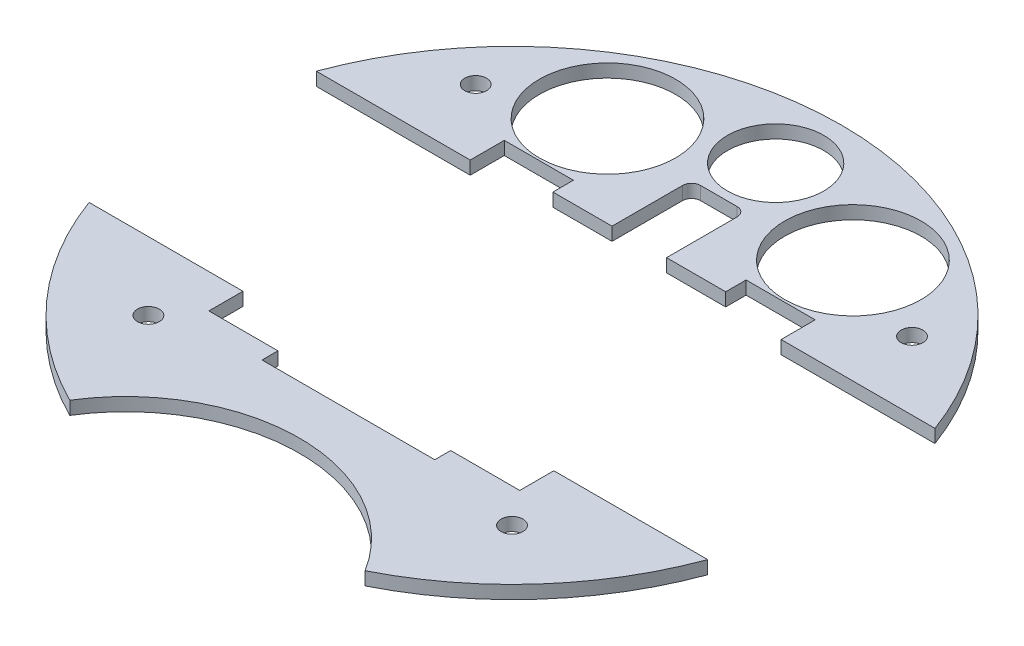
from build123d import *

# Parameters (mm, degrees)
BOSS_EXTRUDE1_DEPTH  = 2.9
SOLENOID_PLACEMENT_W = 38
SOLENOID_PLACEMENT_H = 64
CUT_EXTRUDE1_DEPTH   = 103.571487266
SKETCH7_R            = 15
CUT_EXTRUDE6_DEPTH   = 103.571487266
SKETCH8_R            = 2.4
CUT_EXTRUDE7_DEPTH   = 103.571487266
CUT_EXTRUDE3_DEPTH   = 103.571487266
CUT_EXTRUDE8_DEPTH   = 100.478188564
SKETCH10_R           = 10.605
CUT_EXTRUDE9_DEPTH   = 100.478188564


with BuildPart() as part:
    # Sketch1 → Boss-Extrude1 (new body)
    with BuildSketch(Plane(origin=(0, 0, 0), x_dir=(1, 0, 0), z_dir=(0, 1, 0))):
        with BuildLine():
            ThreePointArc((32.48910875, -64.812867647), (0, 72.5), (-32.48910875, -64.812867647))
            ThreePointArc((-32.48910875, -64.812867647), (0, -46.75), (32.48910875, -64.812867647))
        make_face()
    extrude(amount=BOSS_EXTRUDE1_DEPTH)

    # solenoid placement → Cut-Extrude1 (cut, through all)
    with BuildSketch(Plane(origin=(0, 2.9, 0), x_dir=(1, 0, 0), z_dir=(0, 1, 0))):
        with Locations((0, -4)):
            Rectangle(SOLENOID_PLACEMENT_W, SOLENOID_PLACEMENT_H)
    extrude(amount=-CUT_EXTRUDE1_DEPTH, mode=Mode.SUBTRACT)

    # Sketch7 → Cut-Extrude6 (cut, through all)
    with BuildSketch(Plane(origin=(0, 2.9, 0), x_dir=(1, 0, 0), z_dir=(0, 1, 0))):
        with Locations(Location((27, 48, 0), (0, 0, 270))):
            Circle(SKETCH7_R)
        with Locations(Location((-27, 48, 0), (0, 0, 270))):
            Circle(SKETCH7_R)
    extrude(amount=-CUT_EXTRUDE6_DEPTH, mode=Mode.SUBTRACT)

    # Sketch8 → Cut-Extrude7 (cut, through all)
    with BuildSketch(Plane(origin=(0, 2.9, 0), x_dir=(1, 0, 0), z_dir=(0, 1, 0))):
        with Locations(Location((40, -40, 0), (0, 0, 270))):
            Circle(SKETCH8_R)
        with Locations(Location((-40, -40, 0), (0, 0, 270))):
            Circle(SKETCH8_R)
        with Locations(Location((48, 40, 0), (0, 0, 270))):
            Circle(SKETCH8_R)
        with Locations(Location((-48, 40, 0), (0, 0, 270))):
            Circle(SKETCH8_R)
    extrude(amount=-CUT_EXTRUDE7_DEPTH, mode=Mode.SUBTRACT)

    # Sketch3 → Cut-Extrude3 (cut, through all)
    with BuildSketch(Plane(origin=(0, 2.9, 0), x_dir=(1, 0, 0), z_dir=(0, 1, 0))):
        with BuildLine():
            Line((-34.2, -32.5), (-22.2, -32.5))
            Line((-22.2, -32.5), (-19, -32.5))
            Line((-19, -32.5), (-19, 32.5))
            Line((-19, 32.5), (-22.2, 32.5))
            Line((-22.2, 32.5), (-34.2, 32.5))
            Line((-34.2, 32.5), (-34.2, 25))
            Line((-34.2, 25), (-68.053287944, 25))
            ThreePointArc((-68.053287944, 25), (-72.5, 0), (-68.053287944, -25))
            Line((-68.053287944, -25), (-34.2, -25))
            Line((-34.2, -25), (-34.2, -32.5))
        make_face()
        with BuildLine():
            Line((19, 32.5), (19, -32.5))
            Line((19, -32.5), (22.2, -32.5))
            Line((22.2, -32.5), (34.2, -32.5))
            Line((34.2, -32.5), (34.2, -25))
            Line((34.2, -25), (68.053287944, -25))
            ThreePointArc((68.053287944, -25), (72.5, 0), (68.053287944, 25))
            Line((68.053287944, 25), (34.2, 25))
            Line((34.2, 25), (34.2, 32.5))
            Line((34.2, 32.5), (22.2, 32.5))
            Line((22.2, 32.5), (19, 32.5))
        make_face()
    extrude(amount=-CUT_EXTRUDE3_DEPTH, mode=Mode.SUBTRACT)


with BuildPart() as cut_extrude3_piece_1:
    # of the separate pieces the step leaves, piece 1, a body of its own (cut_extrude3_pieces)
    add(part.part.solids().sort_by_distance((68.053287944, 0, -25))[0])

    # Sketch9 → Cut-Extrude8 (cut, through all)
    with BuildSketch(Plane(origin=(0, 2.9, 0), x_dir=(1, 0, 0), z_dir=(0, 1, 0))):
        with BuildLine():
            Line((6, 43.5), (6, 28))
            Line((6, 28), (-6, 28))
            Line((-6, 28), (-6, 43.5))
            ThreePointArc((-6, 43.5), (-5.414213562, 44.914213562), (-4, 45.5))
            Line((-4, 45.5), (4, 45.5))
            ThreePointArc((4, 45.5), (5.414213562, 44.914213562), (6, 43.5))
        make_face()
    extrude(amount=-CUT_EXTRUDE8_DEPTH, mode=Mode.SUBTRACT)

    # Sketch10 → Cut-Extrude9 (cut, through all)
    with BuildSketch(Plane(origin=(0, 2.9, 0), x_dir=(1, 0, 0), z_dir=(0, 1, 0))):
        with Locations(Location((0, 58, 0), (0, 0, 270))):
            Circle(SKETCH10_R)
    extrude(amount=-CUT_EXTRUDE9_DEPTH, mode=Mode.SUBTRACT)


with BuildPart() as cut_extrude3_piece_2:
    # of the separate pieces the step leaves, piece 2, a body of its own (cut_extrude3_pieces)
    add(part.part.solids().sort_by_distance((32.48910875, 0, 64.812867647))[0])


solid = Compound([cut_extrude3_piece_1.part, cut_extrude3_piece_2.part])
